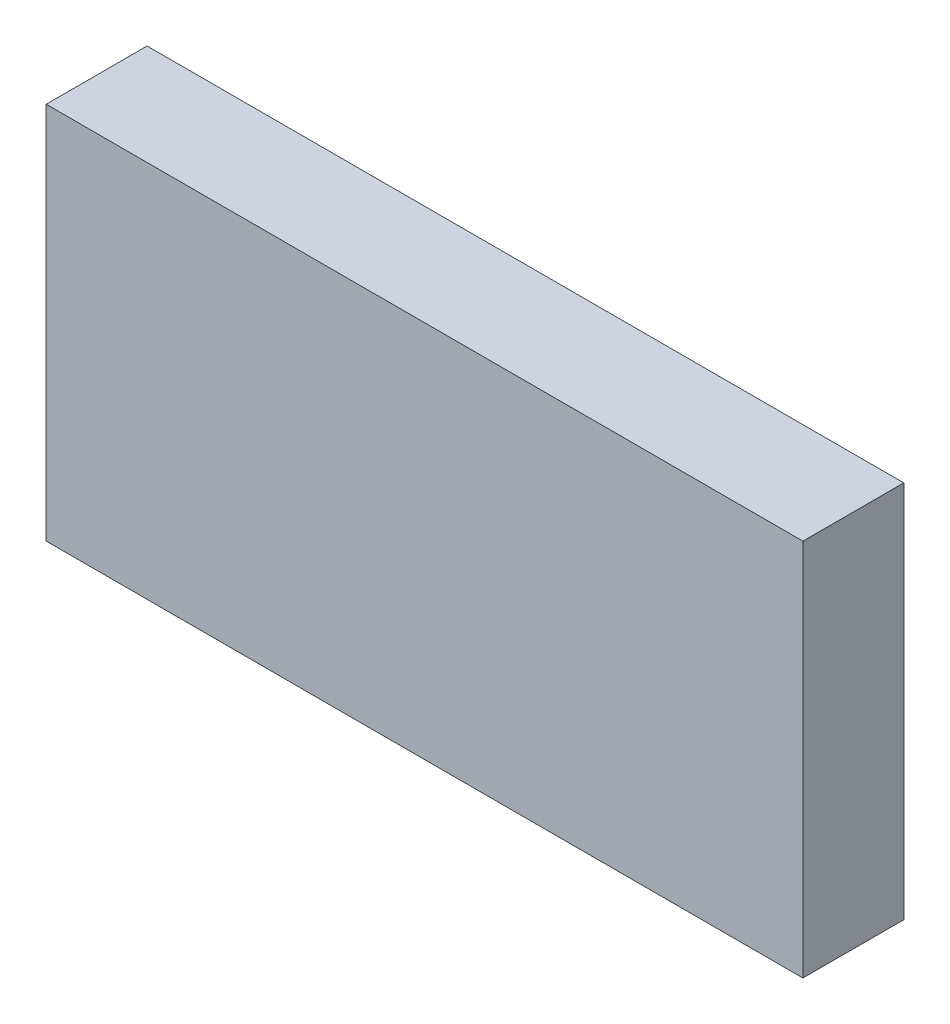
from build123d import *

# Parameters (mm, degrees)
SKETCH_8_W      = 60
SKETCH_8_H      = 30
EXTRUDE_1_DEPTH = 8


with BuildPart() as part:
    # 草图8 → 凸台-拉伸1 (new body)
    with BuildSketch(Plane.XY):
        with Locations((30, 15)):
            Rectangle(SKETCH_8_W, SKETCH_8_H)
    extrude(amount=EXTRUDE_1_DEPTH)


solid = part.part
